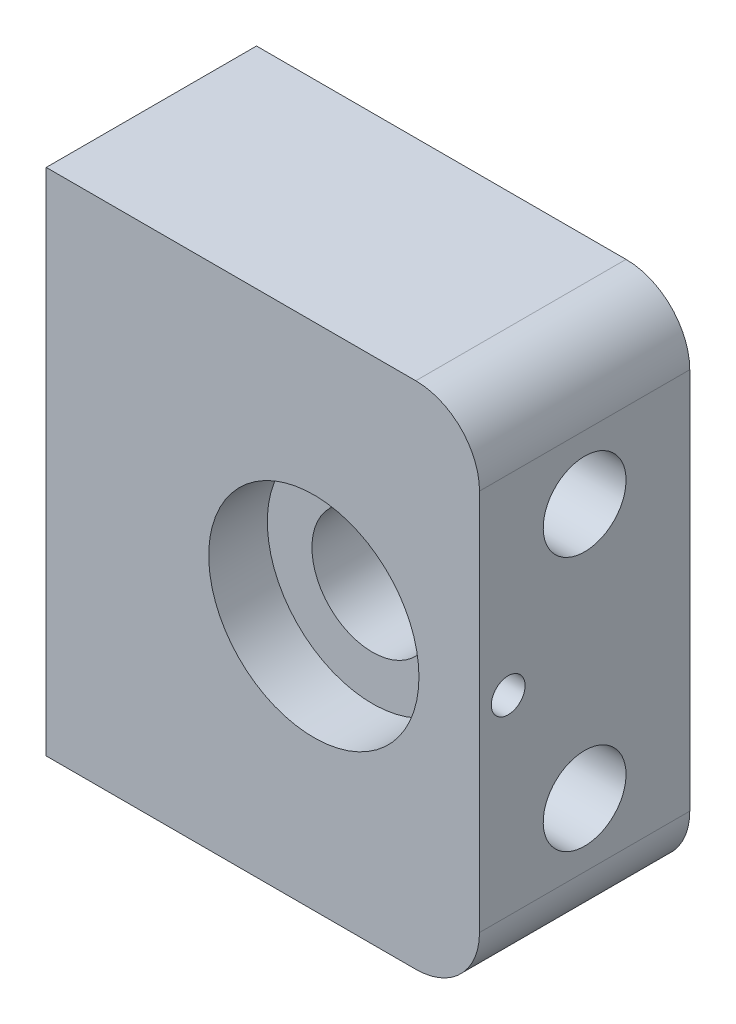
from build123d import *

# Parameters (mm, degrees)
CROQUIS1_W              = 34
CROQUIS1_H              = 40
CROQUIS1_R              = 4.75
SALIENTE_EXTRUIR1_DEPTH = 16.5
CROQUIS2_R              = 8.25
CORTAR_EXTRUIR1_DEPTH   = 4.6
CROQUIS3_R              = 1.325
CORTAR_EXTRUIR2_DEPTH   = 5.6
CORTAR_EXTRUIR3_REACH   = 44.758
CROQUIS4_R              = 1.6
CROQUIS5_R              = 3.25
CORTAR_EXTRUIR4_DEPTH   = 28.6
REDONDEO1_R             = 5


with BuildPart() as part:
    # Croquis1 → Saliente-Extruir1 (new body)
    with BuildSketch(Plane.XY):
        Rectangle(CROQUIS1_W, CROQUIS1_H)
        with Locations((4, 0)):
            Circle(CROQUIS1_R, mode=Mode.SUBTRACT)
    extrude(amount=SALIENTE_EXTRUIR1_DEPTH)

    # Croquis2 → Cortar-Extruir1 (cut)
    with BuildSketch(Plane.XY.offset(16.5)):
        with Locations((4, 0)):
            Circle(CROQUIS2_R)
    extrude(amount=-CORTAR_EXTRUIR1_DEPTH, mode=Mode.SUBTRACT)

    # Croquis3 → Cortar-Extruir2 (cut)
    with BuildSketch(Plane(origin=(17, 0, 0), x_dir=(0, 0, -1), z_dir=(1, 0, 0))):
        with Locations(Location((-14.25, 0, 0), (0, 0, 90))):
            Circle(CROQUIS3_R)
    extrude(amount=-CORTAR_EXTRUIR2_DEPTH, mode=Mode.SUBTRACT)

    # Croquis4 → Cortar-Extruir3 (cut, up to next)
    with BuildSketch(Plane(origin=(17, 0, 0), x_dir=(0, 0, -1), z_dir=(1, 0, 0)), mode=Mode.PRIVATE) as cortar_extruir3_sk1:
        with Locations(Location((-8.25, -10, 0), (0, 0, 90))):
            Circle(CROQUIS4_R)
    cortar_extruir3_tool1 = extrude(cortar_extruir3_sk1.sketch, amount=-CORTAR_EXTRUIR3_REACH, mode=Mode.PRIVATE) & part.part
    # Croquis4 → Cortar-Extruir3 (cut, up to next)
    with BuildSketch(Plane(origin=(17, 0, 0), x_dir=(0, 0, -1), z_dir=(1, 0, 0)), mode=Mode.PRIVATE) as cortar_extruir3_sk2:
        with Locations(Location((-8.25, 10, 0), (0, 0, 90))):
            Circle(CROQUIS4_R)
    cortar_extruir3_tool2 = extrude(cortar_extruir3_sk2.sketch, amount=-CORTAR_EXTRUIR3_REACH, mode=Mode.PRIVATE) & part.part
    add(cortar_extruir3_tool1.solids().sort_by_distance((17, -10, 8.25))[0], mode=Mode.SUBTRACT)
    add(cortar_extruir3_tool2.solids().sort_by_distance((17, 10, 8.25))[0], mode=Mode.SUBTRACT)

    # Croquis5 → Cortar-Extruir4 (cut)
    with BuildSketch(Plane(origin=(17, 0, 0), x_dir=(0, 0, -1), z_dir=(1, 0, 0))):
        with Locations(Location((-8.25, -10, 0), (0, 0, 90))):
            Circle(CROQUIS5_R)
        with Locations(Location((-8.25, 10, 0), (0, 0, 90))):
            Circle(CROQUIS5_R)
    extrude(amount=-CORTAR_EXTRUIR4_DEPTH, mode=Mode.SUBTRACT)

    # Redondeo1
    redondeo1_edges = [part.edges().sort_by_distance(p)[0] for p in [
        (17, 20, 8.25),
        (17, -20, 8.25),
    ]]
    fillet(redondeo1_edges, radius=REDONDEO1_R)


solid = part.part
